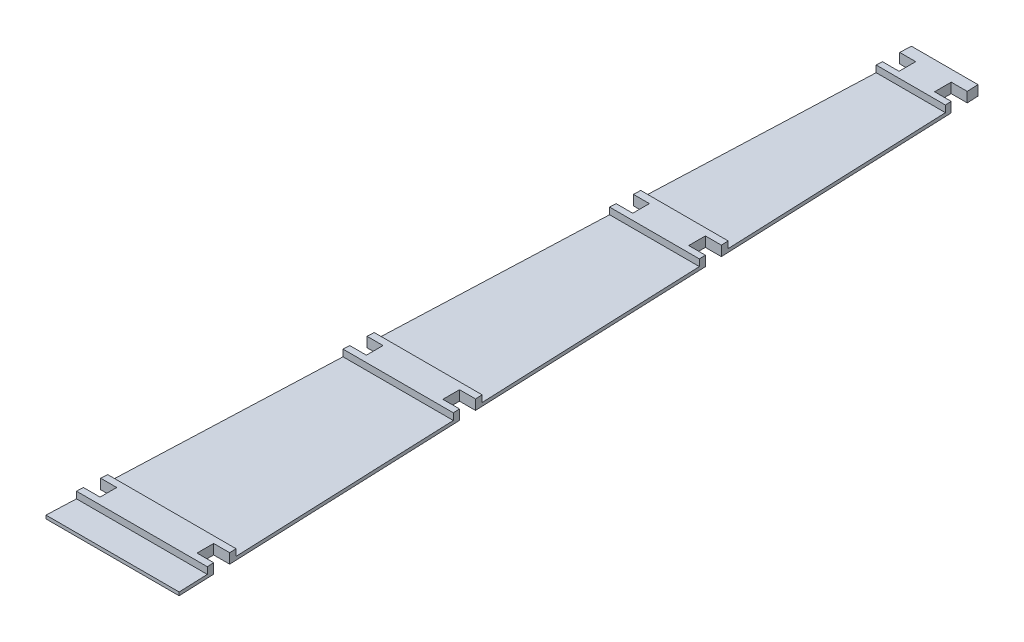
from build123d import *

# Parameters (mm, degrees)
BOSS_EXTRUDE1_DEPTH = 0.5
BOSS_EXTRUDE2_DEPTH = 1


with BuildPart() as part:
    # Sketch2 → Boss-Extrude1 (new body)
    with BuildSketch(Plane(origin=(0, 0, 0), x_dir=(1, 0, 0), z_dir=(0, 1, 0))):
        Polygon((0.216060204, 5.401505112), (0, 0), (20, 0), (19.783939796, 5.401505112), (17.280808425, 5.401505112), (17.280808425, 7.904636482), (19.683814541, 7.904636482), (18.245170319, 43.870742022), (15.742038949, 43.870742022), (15.742038949, 46.373873393), (18.145045064, 46.373873393), (16.706400843, 82.339978933), (14.203269472, 82.339978933), (14.203269472, 84.843110303), (16.606275588, 84.843110303), (15.167631366, 120.809215844), (12.664499996, 120.809215844), (12.664499996, 123.312347214), (15.067506111, 123.312347214), (15, 125), (5, 125), (4.932493889, 123.312347214), (7.335500004, 123.312347214), (7.335500004, 120.809215844), (4.832368634, 120.809215844), (3.393724412, 84.843110303), (5.796730528, 84.843110303), (5.796730528, 82.339978933), (3.293599157, 82.339978933), (1.854954936, 46.373873393), (4.257961051, 46.373873393), (4.257961051, 43.870742022), (1.754829681, 43.870742022), (0.316185459, 7.904636482), (2.719191575, 7.904636482), (2.719191575, 5.401505112), align=None)
    extrude(amount=BOSS_EXTRUDE1_DEPTH)

    # Sketch3 → Boss-Extrude2 (add)
    with BuildSketch(Plane(origin=(0, 0.5, 0), x_dir=(1, 0, 0), z_dir=(0, 1, 0))):
        Polygon((0.216060204, 5.401505112), (0.176060204, 4.401505112), (19.823939796, 4.401505112), (19.783939796, 5.401505112), (17.280808425, 5.401505112), (17.280808425, 7.904636482), (19.683814541, 7.904636482), (19.643814541, 8.904636482), (0.356185459, 8.904636482), (0.316185459, 7.904636482), (2.719191575, 7.904636482), (2.719191575, 5.401505112), align=None)
        Polygon((1.754829681, 43.870742022), (1.716060204, 42.901505112), (18.283939796, 42.901505112), (18.245170319, 43.870742022), (15.742038949, 43.870742022), (15.742038949, 46.373873393), (18.145045064, 46.373873393), (18.103814541, 47.404636482), (1.896185459, 47.404636482), (1.854954936, 46.373873393), (4.257961051, 46.373873393), (4.257961051, 43.870742022), align=None)
        Polygon((3.293599157, 82.339978933), (3.256060204, 81.401505112), (16.743939796, 81.401505112), (16.706400843, 82.339978933), (14.203269472, 82.339978933), (14.203269472, 84.843110303), (16.606275588, 84.843110303), (16.563814541, 85.904636482), (3.436185459, 85.904636482), (3.393724412, 84.843110303), (5.796730528, 84.843110303), (5.796730528, 82.339978933), align=None)
        Polygon((4.832368634, 120.809215844), (4.796060204, 119.901505112), (15.203939796, 119.901505112), (15.167631366, 120.809215844), (12.664499996, 120.809215844), (12.664499996, 123.312347214), (15.067506111, 123.312347214), (15.023814541, 124.404636482), (4.976185459, 124.404636482), (4.932493889, 123.312347214), (7.335500004, 123.312347214), (7.335500004, 120.809215844), align=None)
        Polygon((5, 125), (4.976185459, 124.404636482), (15.023814541, 124.404636482), (15, 125), align=None)
    extrude(amount=BOSS_EXTRUDE2_DEPTH)


solid = part.part
